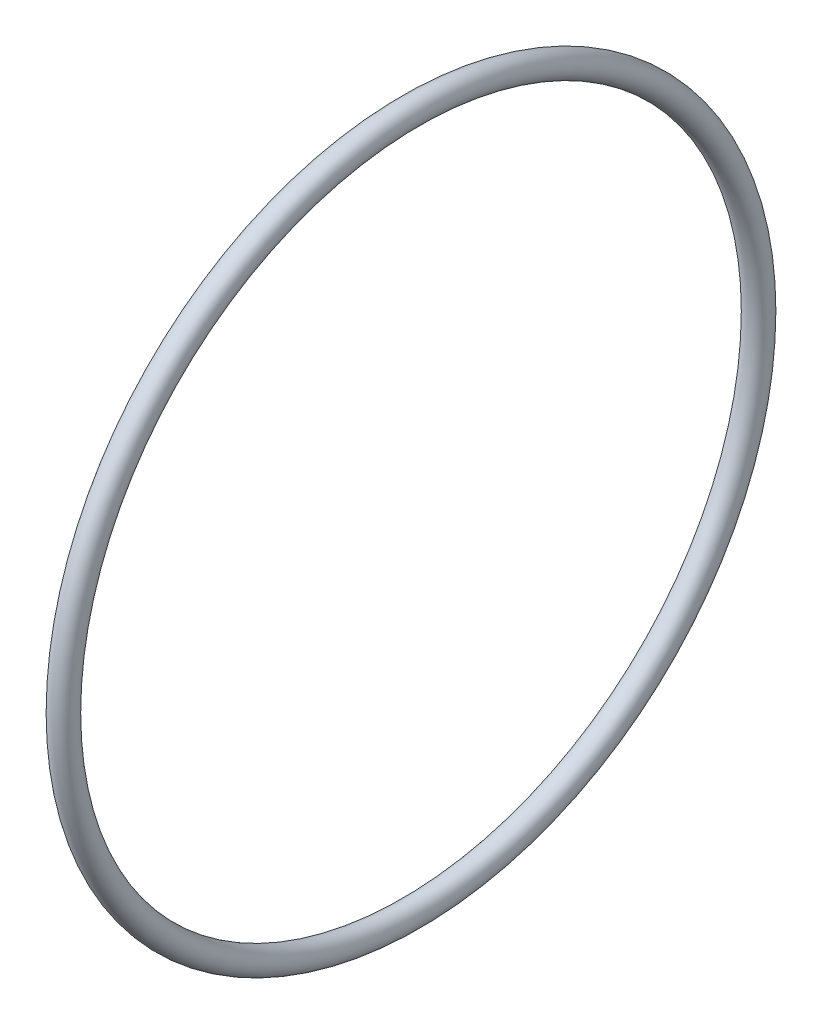
from build123d import *

# Parameters (mm, degrees)
SKETCH_1_R = 1.55


with BuildPart() as part:
    # ｽｹｯﾁ1 → Oリング (revolve)
    with BuildSketch(Plane.XY, mode=Mode.PRIVATE) as revolve_o_sk:
        with Locations((0, 44.05)):
            Circle(SKETCH_1_R)
    revolve(revolve_o_sk.sketch.rotate(Axis((0, 0, 0), (1, 0, 0)), 90), axis=Axis((0, 0, 0), (1, 0, 0)))


solid = part.part
